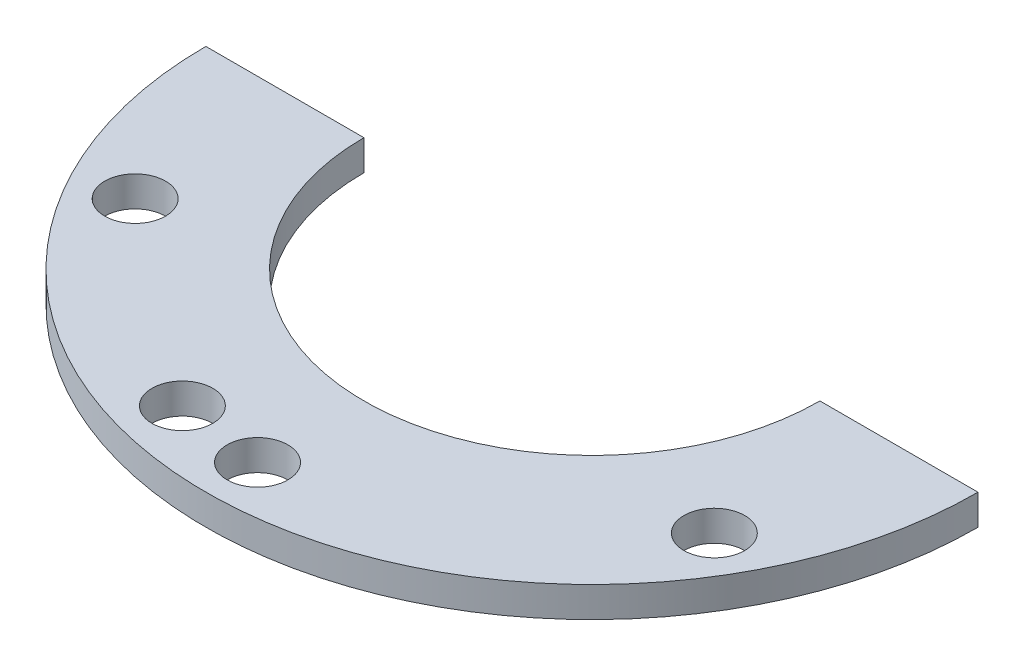
from build123d import *

# Parameters (mm, degrees)
SKETCH1_R               = 12.7
BOSS_EXTRUDE1_DEPTH     = 1
CUT_EXTRUDE1_DEPTH      = 18.98832955
CUT_EXTRUDE1_DEPTH_BACK = 18.98832955
SKETCH19_R              = 1
CUT_EXTRUDE2_DEPTH      = 18.98832955
CUT_EXTRUDE2_DEPTH_BACK = 18.98832955
SKETCH20_R              = 7.5
SKETCH21_W              = 65.874202484
SKETCH21_H              = 51.979273979
CUT_EXTRUDE3_DEPTH      = 18.98832955


with BuildPart() as part:
    # Sketch1 → Boss-Extrude1 (new body)
    with BuildSketch(Plane(origin=(0, 0, 0), x_dir=(1, 0, 0), z_dir=(0, 1, 0))):
        with Locations(Location((0, 0, 0), (0, 0, 270))):
            Circle(SKETCH1_R)
    extrude(amount=BOSS_EXTRUDE1_DEPTH)

    # Sketch19 → Cut-Extrude1 (cut, two sides: drawn at the far end of the back side and taken through both)
    with BuildSketch(Plane(origin=(0, 1, 0), x_dir=(1, 0, 0), z_dir=(0, 1, 0)).offset(-CUT_EXTRUDE1_DEPTH_BACK)):
        with Locations(Location((0, 11, 0), (0, 0, 270))):
            Circle(SKETCH19_R)
        with Locations(Location((9.526279442, 5.5, 0), (0, 0, 270))):
            Circle(SKETCH19_R)
        with Locations(Location((9.526279442, -5.5, 0), (0, 0, 270))):
            Circle(SKETCH19_R)
        with Locations(Location((0, -11, 0), (0, 0, 270))):
            Circle(SKETCH19_R)
        with Locations(Location((-9.526279442, -5.5, 0), (0, 0, 270))):
            Circle(SKETCH19_R)
        with Locations(Location((-9.526279442, 5.5, 0), (0, 0, 270))):
            Circle(SKETCH19_R)
        with Locations(Location((-2.847009496, -10.625184089, 0), (0, 0, 270))):
            Circle(SKETCH19_R)
    extrude(amount=CUT_EXTRUDE1_DEPTH + CUT_EXTRUDE1_DEPTH_BACK, mode=Mode.SUBTRACT)

    # Sketch20 → Cut-Extrude2 (cut, two sides: drawn at the far end of the back side and taken through both)
    with BuildSketch(Plane(origin=(0, 1, 0), x_dir=(1, 0, 0), z_dir=(0, 1, 0)).offset(-CUT_EXTRUDE2_DEPTH_BACK)):
        with Locations(Location((0, 0, 0), (0, 0, 270))):
            Circle(SKETCH20_R)
    extrude(amount=CUT_EXTRUDE2_DEPTH + CUT_EXTRUDE2_DEPTH_BACK, mode=Mode.SUBTRACT)

    # Sketch21 → Cut-Extrude3 (cut, through all)
    with BuildSketch(Plane.XY):
        with Locations((-3.816154381, 6.321647006)):
            Rectangle(SKETCH21_W, SKETCH21_H)
    extrude(amount=-CUT_EXTRUDE3_DEPTH, mode=Mode.SUBTRACT)


solid = part.part
